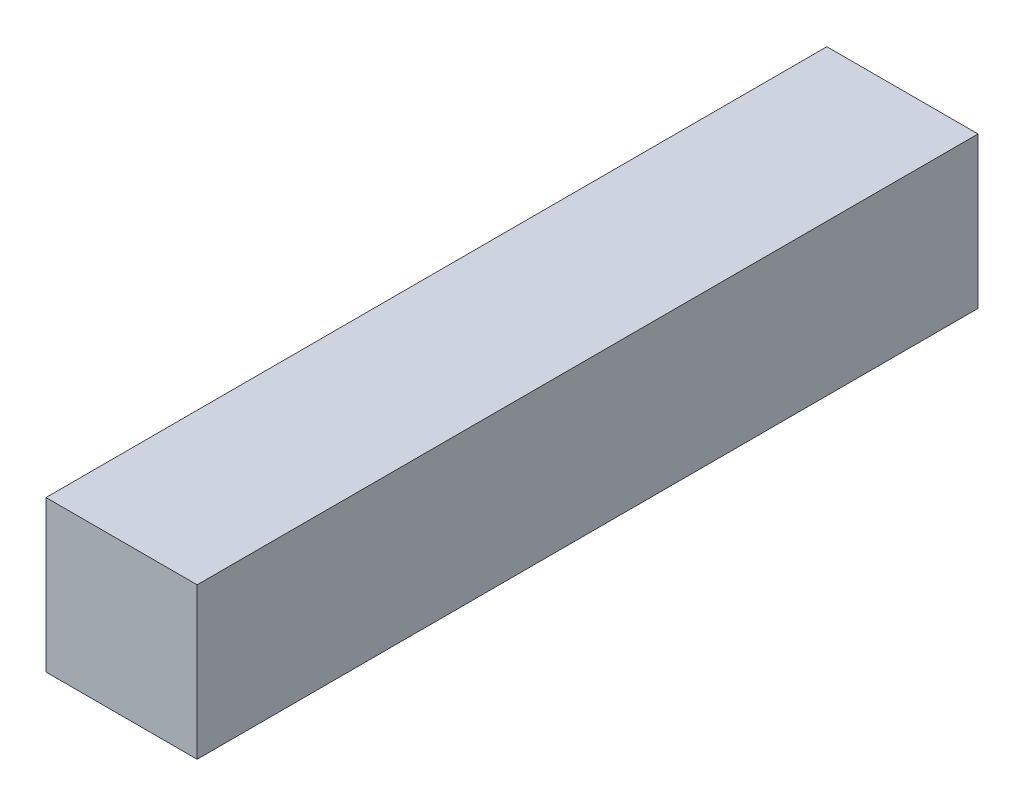
from build123d import *

# Parameters (mm, degrees)
SKETCH1_W           = 76.2
SKETCH1_H           = 393.7
BOSS_EXTRUDE1_DEPTH = 76.2


with BuildPart() as part:
    # Sketch1 → Boss-Extrude1 (new body)
    with BuildSketch(Plane(origin=(0, 0, 0), x_dir=(1, 0, 0), z_dir=(0, 1, 0))):
        Rectangle(SKETCH1_W, SKETCH1_H)
    extrude(amount=BOSS_EXTRUDE1_DEPTH)


solid = part.part
